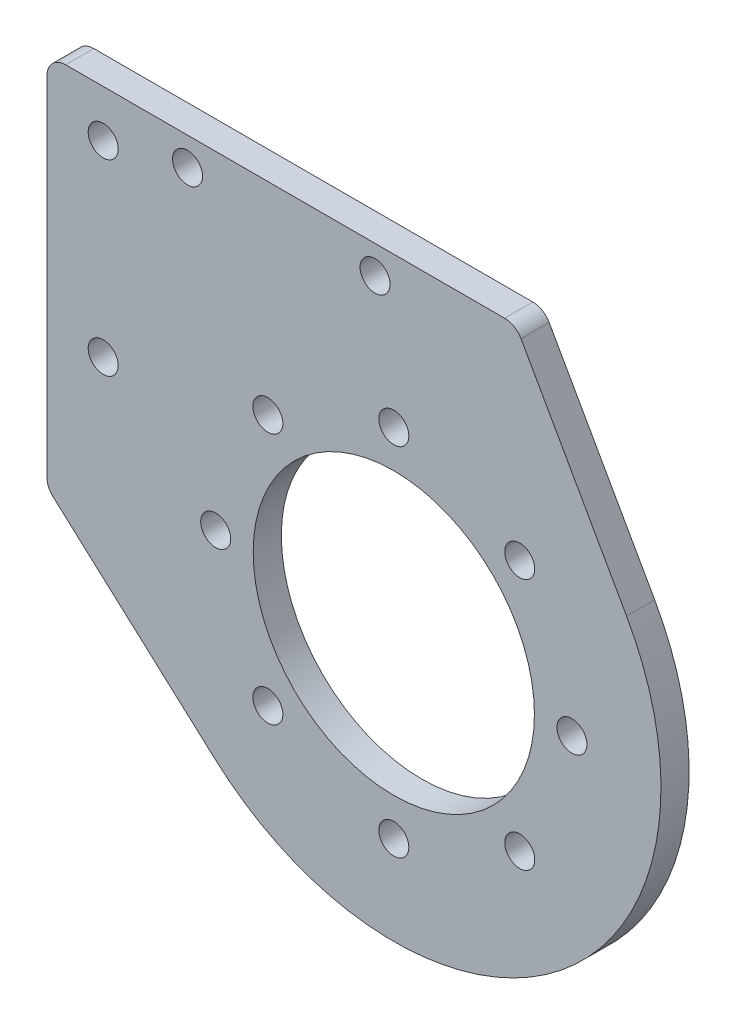
from build123d import *

# Parameters (mm, degrees)
SKETCH_2_R      = 28.5
SKETCH_2_R_2    = 15
SKETCH_2_R_3    = 1.6
EXTRUDE_1_DEPTH = 3
EXTRUDE_START   = -3
SKETCH_4_R      = 1.6
EXTRUDE_2_DEPTH = 3


with BuildPart() as part:
    # 草图2 → 凸台-拉伸1 (new body)
    with BuildSketch(Plane.XY):
        Circle(SKETCH_2_R)
        Circle(SKETCH_2_R_2, mode=Mode.SUBTRACT)
        with Locations((0, 19)):
            Circle(SKETCH_2_R_3, mode=Mode.SUBTRACT)
        with Locations((13.435028843, 13.435028843)):
            Circle(SKETCH_2_R_3, mode=Mode.SUBTRACT)
        with Locations((19, 0)):
            Circle(SKETCH_2_R_3, mode=Mode.SUBTRACT)
        with Locations((13.435028843, -13.435028843)):
            Circle(SKETCH_2_R_3, mode=Mode.SUBTRACT)
        with Locations((0, -19)):
            Circle(SKETCH_2_R_3, mode=Mode.SUBTRACT)
        with Locations((-13.435028843, -13.435028843)):
            Circle(SKETCH_2_R_3, mode=Mode.SUBTRACT)
        with Locations((-19, 0)):
            Circle(SKETCH_2_R_3, mode=Mode.SUBTRACT)
        with Locations((-13.435028843, 13.435028843)):
            Circle(SKETCH_2_R_3, mode=Mode.SUBTRACT)
    extrude(amount=EXTRUDE_1_DEPTH)

    # 草图4 → 凸台-拉伸2 (add)
    with BuildSketch(Plane.XY.offset(3).offset(EXTRUDE_START)):
        with BuildLine():
            Line((-36.339888851, -5.595677643), (-19.093416125, -21.158720677))
            ThreePointArc((-19.093416125, -21.158720677), (-17.803808855, 22.254761069), (24.833892005, 13.983125827))
            Line((24.833892005, 13.983125827), (13.573611336, 33.981271988))
            ThreePointArc((13.573611336, 33.981271988), (12.840202642, 34.726636032), (11.830882073, 35))
            Line((11.830882073, 35), (-35, 35))
            ThreePointArc((-35, 35), (-36.414213562, 34.414213562), (-37, 33))
            Line((-37, 33), (-37, -4.110855139))
            ThreePointArc((-37, -4.110855139), (-36.827536279, -4.923327384), (-36.339888851, -5.595677643))
        make_face()
        with Locations((-31, 30)):
            Circle(SKETCH_4_R, mode=Mode.SUBTRACT)
        with Locations((-31, 10)):
            Circle(SKETCH_4_R, mode=Mode.SUBTRACT)
        with Locations((-22, 32)):
            Circle(SKETCH_4_R, mode=Mode.SUBTRACT)
        with Locations((-2, 32)):
            Circle(SKETCH_4_R, mode=Mode.SUBTRACT)
    extrude(amount=EXTRUDE_2_DEPTH)


solid = part.part
